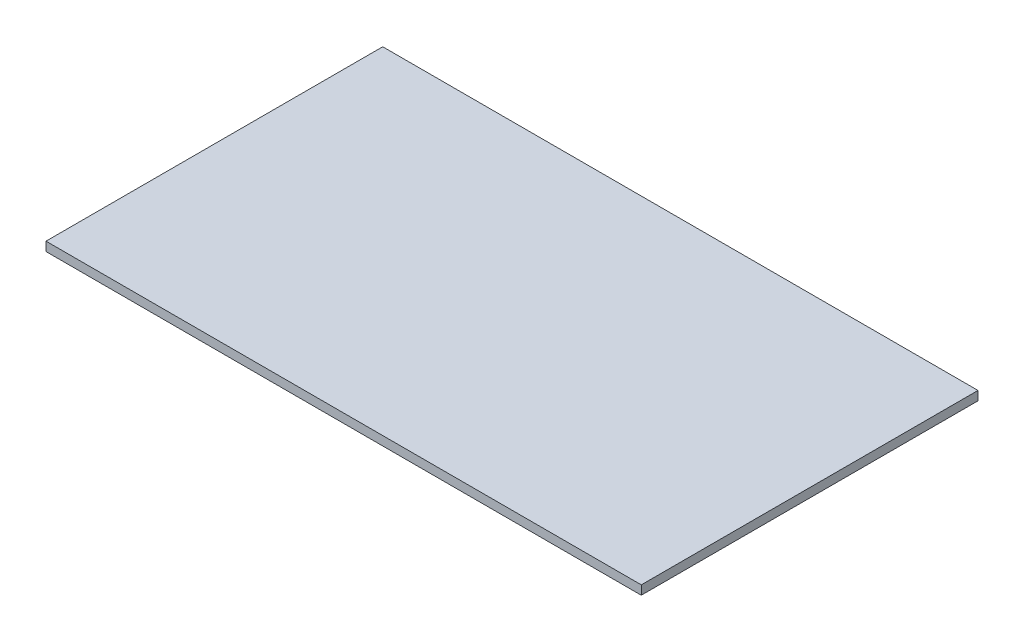
from build123d import *

# Parameters (mm, degrees)
SKETCH1_W     = 198
SKETCH1_H     = 3
PROFILE_DEPTH = 112


with BuildPart() as part:
    # Sketch1 → Profile (new body)
    with BuildSketch(Plane.XY):
        with Locations((99, 1.5)):
            Rectangle(SKETCH1_W, SKETCH1_H)
    extrude(amount=PROFILE_DEPTH)


solid = part.part
